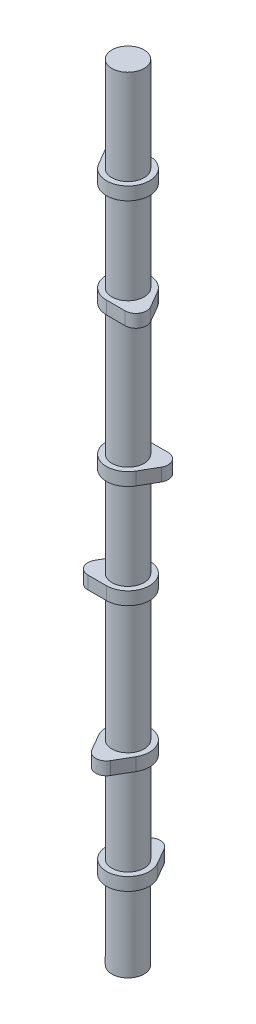
from build123d import *

# Parameters (mm, degrees)
BOSS_EXTRUDE1_DEPTH   = 3.81
BODY_MOVE_COPY2_ANGLE = 180
BOSS_EXTRUDE2_START   = -25.4
SKETCH3_R             = 9.5
BOSS_EXTRUDE2_DEPTH   = 146.05
LPATTERN1_COUNT       = 3
LPATTERN1_PITCH       = 146.05
BODY_MOVE_COPY3_ANGLE = 120
BODY_MOVE_COPY4_ANGLE = 120
BOSS_EXTRUDE3_START   = 24.94
SKETCH4_R             = 9.5
BOSS_EXTRUDE3_DEPTH   = 24.94


with BuildPart() as part:
    # Sketch2 → Boss-Extrude1 (new, symmetric)
    with BuildSketch(Plane(origin=(0, 0, 0), x_dir=(1, 0, 0), z_dir=(0, 1, 0))):
        with BuildLine():
            Line((-5.499261314, 15.875), (-10.998522628, 6.35))
            ThreePointArc((-10.998522628, 6.35), (0, -12.7), (10.998522628, 6.35))
            Line((10.998522628, 6.35), (5.499261314, 15.875))
            ThreePointArc((5.499261314, 15.875), (0, 19.05), (-5.499261314, 15.875))
        make_face()
    extrude(amount=BOSS_EXTRUDE1_DEPTH, both=True)


with BuildPart() as body_2:
    # Body-Move/Copy1: copy of part
    add(part.part.moved(Location((0, 60.96, 0))))


with BuildPart() as body_2_1:
    # Body-Move/Copy2: moved
    add(body_2.part.rotate(Axis((0, 0, 0), (0, 1, 0)), BODY_MOVE_COPY2_ANGLE))


with BuildPart() as part_1:
    add(part.part)

    add(body_2_1.part)  # Boss-Extrude2 merges body 2
    # Sketch3 → Boss-Extrude2 (add)
    with BuildSketch(Plane(origin=(0, 0, 0), x_dir=(1, 0, 0), z_dir=(0, 1, 0)).offset(BOSS_EXTRUDE2_START)):
        Circle(SKETCH3_R)
    extrude(amount=BOSS_EXTRUDE2_DEPTH)


with BuildPart() as lpattern1_1:
    # LPattern1: pattern copy
    add(part_1.part.moved(Location(Vector(0, 1, 0) * (1 * LPATTERN1_PITCH))))


with BuildPart() as lpattern1_2:
    # LPattern1: pattern copy
    add(part_1.part.moved(Location(Vector(0, 1, 0) * (2 * LPATTERN1_PITCH))))


with BuildPart() as lpattern1_1_1:
    # Body-Move/Copy3: moved
    add(lpattern1_1.part.rotate(Axis((0, 0, 0), (0, 1, 0)), BODY_MOVE_COPY3_ANGLE))


with BuildPart() as lpattern1_2_1:
    # Body-Move/Copy4: moved
    add(lpattern1_2.part.rotate(Axis((0, 0, 0), (0, -1, 0)), BODY_MOVE_COPY4_ANGLE))


with BuildPart() as part_2:
    add(part_1.part)

    # Sketch4 → Boss-Extrude3 (add)
    with BuildSketch(Plane.XZ.offset(25.4).offset(BOSS_EXTRUDE3_START)):
        Circle(SKETCH4_R)
    extrude(amount=-BOSS_EXTRUDE3_DEPTH)


with BuildPart() as lpattern1_2_2:
    add(lpattern1_2_1.part)

    # Combine1: union LPattern1_1, part
    add(lpattern1_1_1.part)
    add(part_2.part)


solid = lpattern1_2_2.part
